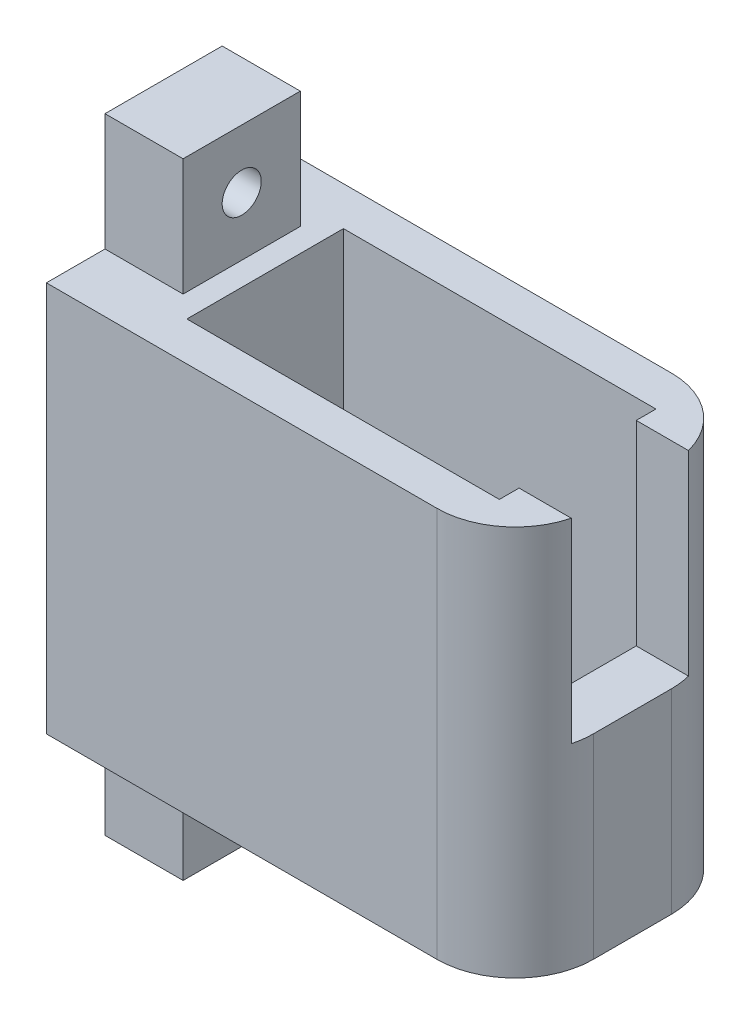
from build123d import *

# Parameters (mm, degrees)
BOSS_EXTRUDE1_DEPTH = 15
CUT_EXTRUDE1_START  = -7
SKETCH2_W           = 20.04
SKETCH2_H           = 45
CUT_EXTRUDE1_DEPTH  = 40
SKETCH5_R           = 10.02
CUT_EXTRUDE2_DEPTH  = 40
SKETCH6_W           = 15
SKETCH6_H           = 25
CUT_EXTRUDE3_DEPTH  = 40
SKETCH7_R           = 2.5
SKETCH7_W           = 7.5
SKETCH7_H           = 15
CUT_EXTRUDE4_DEPTH  = 40
FILLET1_R           = 10


with BuildPart() as part:
    # Sketch1 → Boss-Extrude1 (new, symmetric)
    with BuildSketch(Plane.XY):
        Polygon((-10, 40), (-10, -40), (0, -40), (0, -25), (50, -25), (50, 25), (0, 25), (0, 40), align=None)
    extrude(amount=BOSS_EXTRUDE1_DEPTH, both=True)

    # Sketch2 → Cut-Extrude1 (cut)
    with BuildSketch(Plane(origin=(50, 0, 0), x_dir=(0, 0, -1), z_dir=(1, 0, 0)).offset(CUT_EXTRUDE1_START)):
        with Locations((0, 2.5)):
            Rectangle(SKETCH2_W, SKETCH2_H)
    extrude(amount=-CUT_EXTRUDE1_DEPTH, mode=Mode.SUBTRACT)

    # Sketch5 → Cut-Extrude2 (cut)
    with BuildSketch(Plane(origin=(0, -20, 0), x_dir=(1, 0, 0), z_dir=(0, 1, 0))):
        with Locations(Location((32.98, 0, 0), (0, 0, 270))):
            Circle(SKETCH5_R)
    extrude(amount=-CUT_EXTRUDE2_DEPTH, mode=Mode.SUBTRACT)

    # Sketch6 → Cut-Extrude3 (cut)
    with BuildSketch(Plane(origin=(50, 0, 0), x_dir=(0, 0, -1), z_dir=(1, 0, 0))):
        with Locations((0, 12.5)):
            Rectangle(SKETCH6_W, SKETCH6_H)
    extrude(amount=-CUT_EXTRUDE3_DEPTH, mode=Mode.SUBTRACT)

    # Sketch7 → Cut-Extrude4 (cut)
    with BuildSketch(Plane(origin=(0, 0, 0), x_dir=(0, 0, -1), z_dir=(1, 0, 0))):
        with Locations((0, 32.5)):
            Circle(SKETCH7_R)
        with Locations((0, -32.5)):
            Circle(SKETCH7_R)
        with Locations((11.25, 32.5)):
            Rectangle(SKETCH7_W, SKETCH7_H)
        with Locations((-11.25, 32.5)):
            Rectangle(SKETCH7_W, SKETCH7_H)
        with Locations((-11.25, -32.5)):
            Rectangle(SKETCH7_W, SKETCH7_H)
        with Locations((11.25, -32.5)):
            Rectangle(SKETCH7_W, SKETCH7_H)
    extrude(amount=-CUT_EXTRUDE4_DEPTH, mode=Mode.SUBTRACT)

    # Fillet1
    fillet1_edges = [part.edges().sort_by_distance(p)[0] for p in [
        (50, 0, -15),
        (50, 0, 15),
    ]]
    fillet(fillet1_edges, radius=FILLET1_R)


solid = part.part
